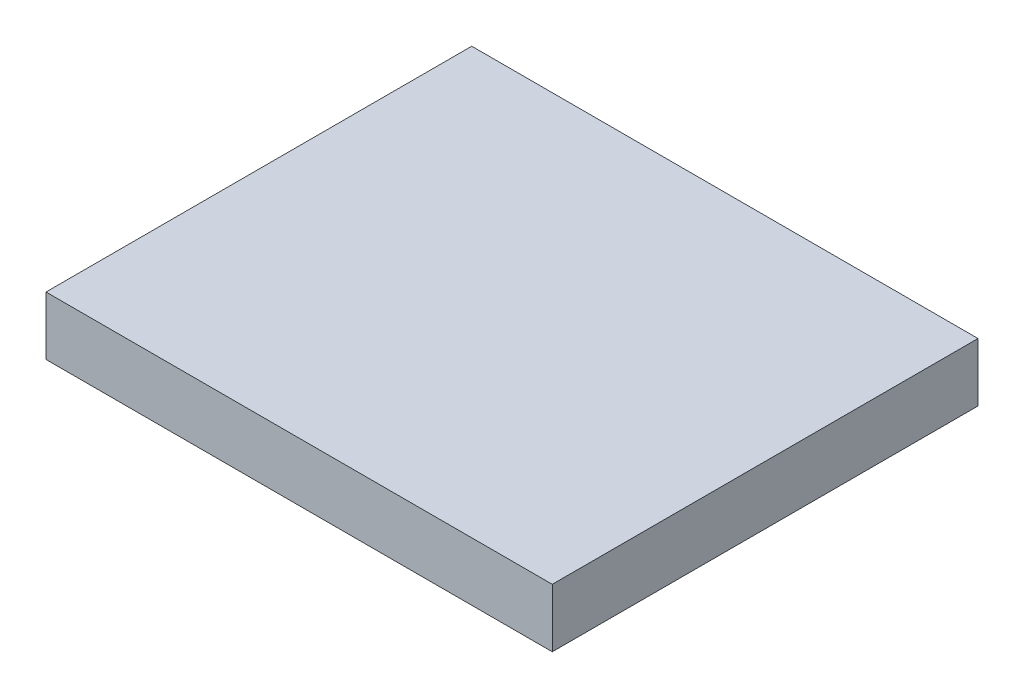
from build123d import *

# Parameters (mm, degrees)
SKETCH1_W           = 220
SKETCH1_H           = 185
BOSS_EXTRUDE1_DEPTH = 25.4


with BuildPart() as part:
    # Sketch1 → Boss-Extrude1 (new body)
    with BuildSketch(Plane(origin=(0, 0, 0), x_dir=(1, 0, 0), z_dir=(0, 1, 0))):
        Rectangle(SKETCH1_W, SKETCH1_H)
    extrude(amount=BOSS_EXTRUDE1_DEPTH)


solid = part.part
